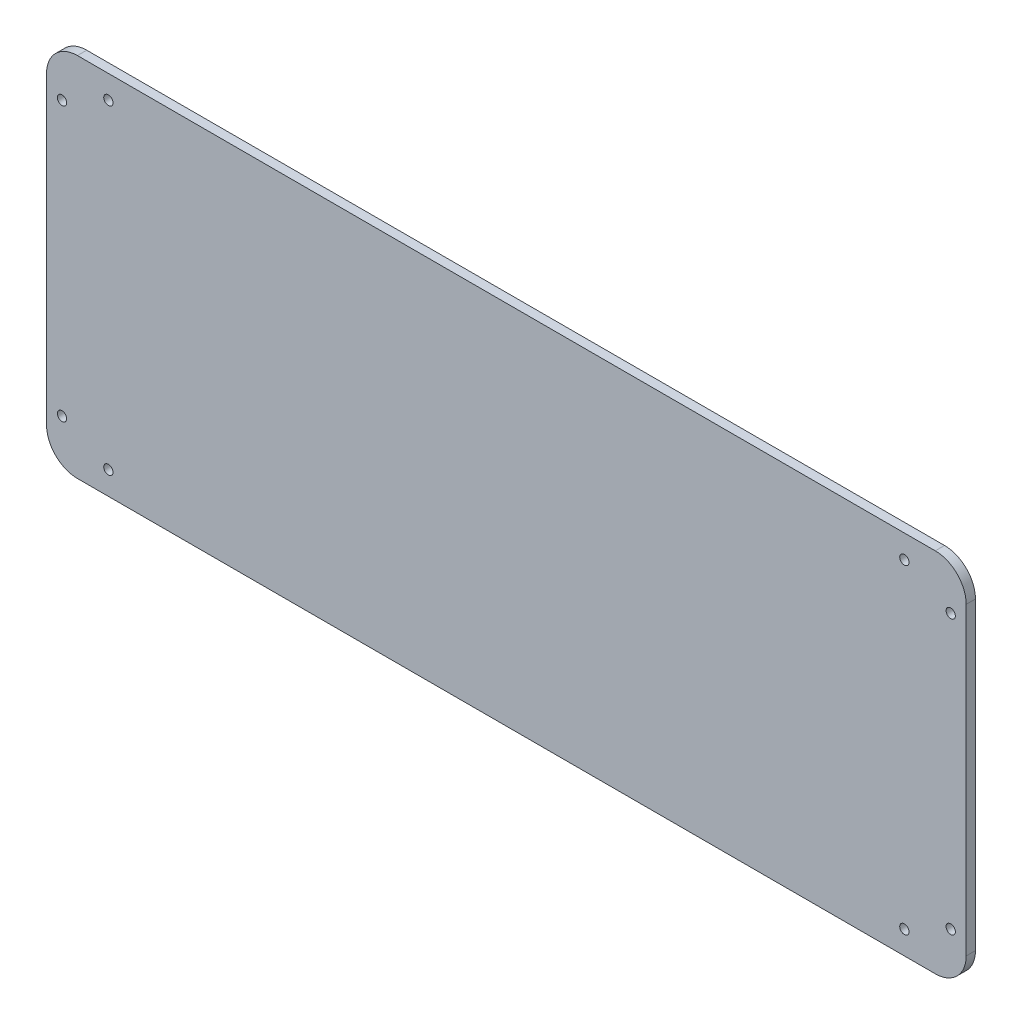
from build123d import *

# Parameters (mm, degrees)
SKETCH1_W           = 297.5
SKETCH1_H           = 118.5
BOSS_EXTRUDE1_DEPTH = 3
SKETCH2_R           = 1.5
CUT_EXTRUDE1_DEPTH  = 3
FILLET1_R           = 10


with BuildPart() as part:
    # Sketch1 → Boss-Extrude1 (new body)
    with BuildSketch(Plane.XY):
        with Locations((148.75, 59.25)):
            Rectangle(SKETCH1_W, SKETCH1_H)
    extrude(amount=BOSS_EXTRUDE1_DEPTH)

    # Sketch2 → Cut-Extrude1 (cut)
    with BuildSketch(Plane.XY.offset(3)):
        with Locations((5, 15)):
            Circle(SKETCH2_R)
        with Locations((20, 7.5)):
            Circle(SKETCH2_R)
        with Locations((20, 111)):
            Circle(SKETCH2_R)
        with Locations((5, 103.5)):
            Circle(SKETCH2_R)
        with Locations((292.5, 15)):
            Circle(SKETCH2_R)
        with Locations((277.5, 7.5)):
            Circle(SKETCH2_R)
        with Locations((292.5, 103.5)):
            Circle(SKETCH2_R)
        with Locations((277.5, 111)):
            Circle(SKETCH2_R)
    extrude(amount=-CUT_EXTRUDE1_DEPTH, mode=Mode.SUBTRACT)

    # Fillet1
    fillet1_edges = [part.edges().sort_by_distance(p)[0] for p in [
        (0, 118.5, 1.5),
        (297.5, 118.5, 1.5),
        (297.5, 0, 1.5),
        (0, 0, 1.5),
    ]]
    fillet(fillet1_edges, radius=FILLET1_R)


solid = part.part
